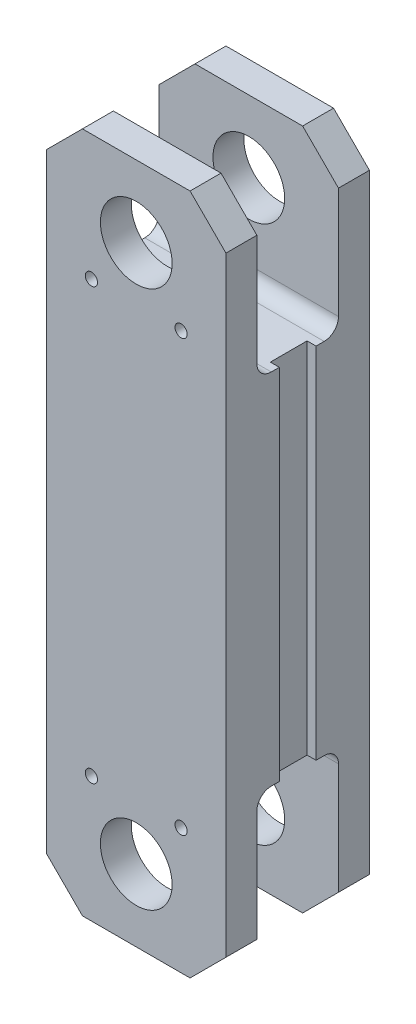
from build123d import *

# Parameters (mm, degrees)
SKETCH_1_W              = 100
SKETCH_1_H              = 380
EXTRUDE_1_DEPTH         = 80
CUT_EXTRUDE_1_REACH     = 231.129
SKETCH_2_W              = 45.5
SKETCH_2_H              = 90
SKETCH_3_W              = 20.5
SKETCH_3_H              = 290
CUT_EXTRUDE_2_DEPTH     = 5
SKETCH_4_R              = 20
CUT_EXTRUDE_3_DEPTH     = 213.132034356
HOLE_WIZARD_M8_1_REACH  = 214.132
HOLE_WIZARD_M8_1_BORE_R = 3.4
FILLET_1_R              = 8
CHAMFER_1_SIZE          = 20


with BuildPart() as part:
    # 草图1 → 凸台-拉伸1 (new body)
    with BuildSketch(Plane.XY):
        Rectangle(SKETCH_1_W, SKETCH_1_H)
    extrude(amount=EXTRUDE_1_DEPTH)

    # 草图2 → 切除-拉伸1 (cut, up to next)
    with BuildSketch(Plane(origin=(50, 0, 0), x_dir=(0, 0, -1), z_dir=(1, 0, 0)), mode=Mode.PRIVATE) as cut_extrude_1_sk1:
        with Locations((-40, 145)):
            Rectangle(SKETCH_2_W, SKETCH_2_H)
    cut_extrude_1_tool1 = extrude(cut_extrude_1_sk1.sketch, amount=-CUT_EXTRUDE_1_REACH, mode=Mode.PRIVATE) & part.part
    cut_extrude_1 = cut_extrude_1_tool1.solids().sort_by_distance((50, 145, 40))[0]
    add(cut_extrude_1, mode=Mode.SUBTRACT)

    # 草图3 → 切除-拉伸2 (cut)
    with BuildSketch(Plane(origin=(50, 0, 0), x_dir=(0, 0, -1), z_dir=(1, 0, 0))):
        with Locations((-40, -45)):
            Rectangle(SKETCH_3_W, SKETCH_3_H)
    cut_extrude_2 = extrude(amount=-CUT_EXTRUDE_2_DEPTH, mode=Mode.SUBTRACT)

    # 镜向1: 切除-拉伸1 across plane
    add(cut_extrude_1.mirror(Plane.ZX), mode=Mode.SUBTRACT)

    # 镜向2: 切除-拉伸2 across plane
    add(cut_extrude_2.mirror(Plane(origin=(0, 0, 0), x_dir=(0, 0, 1), z_dir=(1, 0, 0))), mode=Mode.SUBTRACT)

    # 草图4 → 切除-拉伸3 (cut, through all)
    with BuildSketch(Plane.XY.offset(80)):
        with Locations((0, 150)):
            Circle(SKETCH_4_R)
    cut_extrude_3 = extrude(amount=-CUT_EXTRUDE_3_DEPTH, mode=Mode.SUBTRACT)

    # 镜向3: 切除-拉伸3 across plane
    add(cut_extrude_3.mirror(Plane.ZX), mode=Mode.SUBTRACT)

    # M8 螺纹孔1 bore → M8 螺纹孔1 (cut, up to next)
    with BuildSketch(Plane.XY.offset(80), mode=Mode.PRIVATE) as hole_wizard_m8_1_sk1:
        with Locations((-25, 120)):
            Circle(HOLE_WIZARD_M8_1_BORE_R)
    hole_wizard_m8_1_tool1 = extrude(hole_wizard_m8_1_sk1.sketch, amount=-HOLE_WIZARD_M8_1_REACH, mode=Mode.PRIVATE) & part.part
    # M8 螺纹孔1 bore → M8 螺纹孔1 (cut, up to next)
    with BuildSketch(Plane.XY.offset(80), mode=Mode.PRIVATE) as hole_wizard_m8_1_sk2:
        with Locations((25, 120)):
            Circle(HOLE_WIZARD_M8_1_BORE_R)
    hole_wizard_m8_1_tool2 = extrude(hole_wizard_m8_1_sk2.sketch, amount=-HOLE_WIZARD_M8_1_REACH, mode=Mode.PRIVATE) & part.part
    hole_wizard_m8_1_1 = hole_wizard_m8_1_tool1.solids().sort_by_distance((-25, 120, 80))[0]
    add(hole_wizard_m8_1_1, mode=Mode.SUBTRACT)
    hole_wizard_m8_1_2 = hole_wizard_m8_1_tool2.solids().sort_by_distance((25, 120, 80))[0]
    add(hole_wizard_m8_1_2, mode=Mode.SUBTRACT)
    hole_wizard_m8_1 = hole_wizard_m8_1_1 + hole_wizard_m8_1_2  # M8 螺纹孔1 as one shape, for the pattern or mirror that repeats it

    # 镜向4: M8 螺纹孔1 across plane
    add(hole_wizard_m8_1.mirror(Plane.ZX), mode=Mode.SUBTRACT)

    # 圆角1
    fillet_1_edges = [part.edges().sort_by_distance(p)[0] for p in [
        (0, 100, 17.25),
        (0, 100, 62.75),
        (0, -100, 62.75),
        (0, -100, 17.25),
    ]]
    fillet(fillet_1_edges, radius=FILLET_1_R)

    # 倒角1
    chamfer_1_edges = [part.edges().sort_by_distance(p)[0] for p in [
        (-50, 190, 8.625),
        (50, 190, 8.625),
        (50, -190, 8.625),
        (-50, -190, 8.625),
        (-50, 190, 71.375),
        (50, 190, 71.375),
        (50, -190, 71.375),
        (-50, -190, 71.375),
    ]]
    chamfer(chamfer_1_edges, length=CHAMFER_1_SIZE)


solid = part.part
